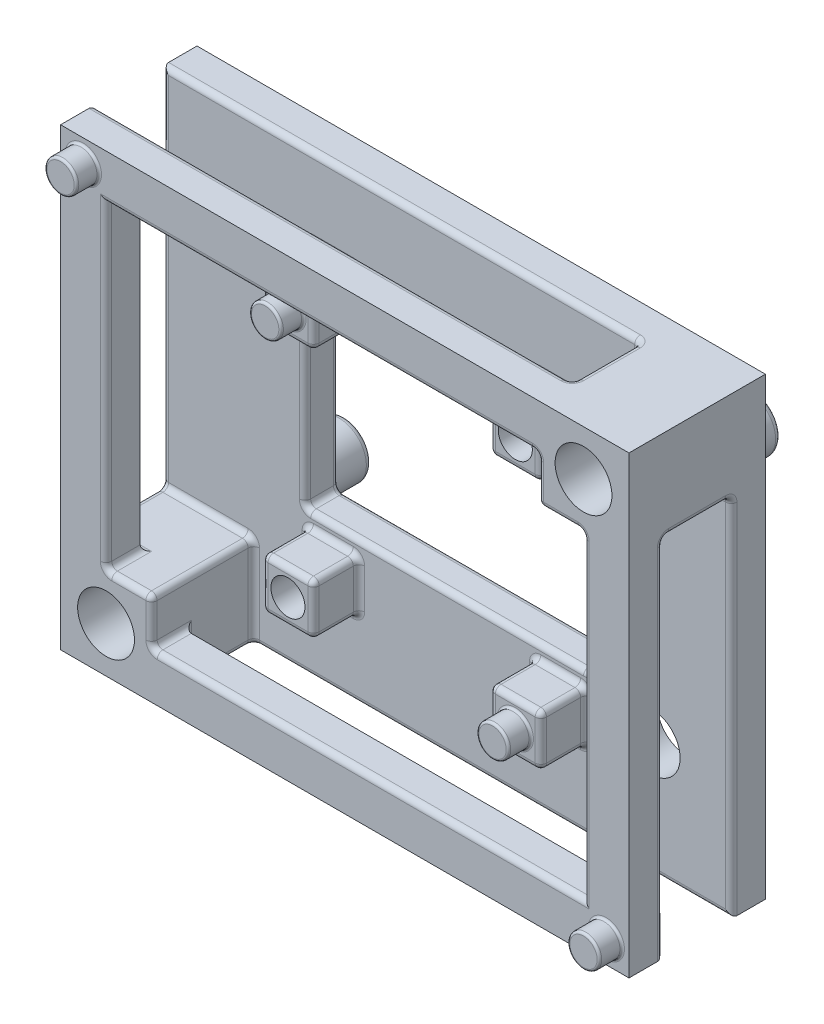
from build123d import *

# Parameters (mm, degrees)
SKETCH1_W           = 50
SKETCH1_H           = 40
BOSS_EXTRUDE1_DEPTH = 3
BOSS_EXTRUDE2_START = 1
SKETCH2_R           = 2.4
BOSS_EXTRUDE2_DEPTH = 7
SKETCH3_R           = 2.5
CUT_EXTRUDE1_DEPTH  = 15
FILLET1_R           = 0.5
SKETCH12_W          = 4.5
SKETCH12_H          = 4.5
SKETCH12_R          = 1.5
BOSS_EXTRUDE3_DEPTH = 7
SKETCH13_W          = 8
SKETCH13_H          = 8
SKETCH13_R          = 2.5
BOSS_EXTRUDE4_DEPTH = 12
BOSS_EXTRUDE5_START = 9
SKETCH14_W          = 50
SKETCH14_H          = 40
SKETCH14_W_2        = 42
SKETCH14_H_2        = 32
BOSS_EXTRUDE5_DEPTH = 3
SKETCH15_R          = 2
BOSS_EXTRUDE6_DEPTH = 7
SKETCH16_R          = 1.4
BOSS_EXTRUDE7_DEPTH = 9
CUT_EXTRUDE2_START  = -1
SKETCH17_R          = 2.5
SKETCH17_R_2        = 1.5
CUT_EXTRUDE2_DEPTH  = 15
FILLET4_R           = 0.5
FILLET5_R           = 0.5
FILLET6_R           = 0.2
FILLET7_R           = 0.2
BOSS_EXTRUDE8_START = 11
SKETCH18_R          = 1.4
BOSS_EXTRUDE8_DEPTH = 3
FILLET8_R           = 0.2
FILLET9_R           = 0.2


with BuildPart() as part:
    # Sketch1 → Boss-Extrude1 (new body)
    with BuildSketch(Plane.XY):
        Rectangle(SKETCH1_W, SKETCH1_H)
    extrude(amount=BOSS_EXTRUDE1_DEPTH)

    # Sketch2 → Boss-Extrude2 (add)
    with BuildSketch(Plane.XY.offset(BOSS_EXTRUDE2_START)):
        with Locations((18, 10)):
            Circle(SKETCH2_R)
        with Locations((-18, -10)):
            Circle(SKETCH2_R)
    extrude(amount=-BOSS_EXTRUDE2_DEPTH)

    # Sketch3 → Cut-Extrude1 (cut)
    with BuildSketch(Plane.XY):
        with Locations((18, -10)):
            Circle(SKETCH3_R)
        with Locations((-18, 10)):
            Circle(SKETCH3_R)
        with BuildLine():
            Line((-12, -7.5), (12, -7.5))
            ThreePointArc((12, -7.5), (12.353553391, -7.353553391), (12.5, -7))
            Line((12.5, -7), (12.5, 7))
            ThreePointArc((12.5, 7), (12.353553391, 7.353553391), (12, 7.5))
            Line((12, 7.5), (-12, 7.5))
            ThreePointArc((-12, 7.5), (-12.353553391, 7.353553391), (-12.5, 7))
            Line((-12.5, 7), (-12.5, -7))
            ThreePointArc((-12.5, -7), (-12.353553391, -7.353553391), (-12, -7.5))
        make_face()
    extrude(amount=CUT_EXTRUDE1_DEPTH, mode=Mode.SUBTRACT)

    # Fillet1
    fillet1_edges = [part.edges().sort_by_distance(p)[0] for p in [
        (15.6, 10, -6),
        (-20.4, -10, -6),
    ]]
    fillet(fillet1_edges, radius=FILLET1_R)

    # Sketch12 → Boss-Extrude3 (add)
    # profile 1 of 4: a face of its own
    with BuildSketch(Plane.XY):
        with Locations((-10, 11)):
            Rectangle(SKETCH12_W, SKETCH12_H)
        with Locations((-10, 11)):
            Circle(SKETCH12_R, mode=Mode.SUBTRACT)
    # profile 2 of 4: a face of its own
    with BuildSketch(Plane.XY):
        with Locations((-10, -11)):
            Rectangle(SKETCH12_W, SKETCH12_H)
        with Locations(Location((-10, -11, 0), (0, 0, 180))):
            Circle(SKETCH12_R, mode=Mode.SUBTRACT)
    # profile 3 of 4: a face of its own
    with BuildSketch(Plane.XY):
        with Locations((10, -11)):
            Rectangle(SKETCH12_W, SKETCH12_H)
        with Locations((10, -11)):
            Circle(SKETCH12_R, mode=Mode.SUBTRACT)
    # profile 4 of 4: a face of its own
    with BuildSketch(Plane.XY):
        with Locations((10, 11)):
            Rectangle(SKETCH12_W, SKETCH12_H)
        with Locations(Location((10, 11, 0), (0, 0, 180))):
            Circle(SKETCH12_R, mode=Mode.SUBTRACT)
    extrude(amount=BOSS_EXTRUDE3_DEPTH)

    # Sketch13 → Boss-Extrude4 (add)
    # profile 1 of 2: a face of its own
    with BuildSketch(Plane.XY):
        with Locations((21, 16)):
            Rectangle(SKETCH13_W, SKETCH13_H)
        with Locations((21, 16)):
            Circle(SKETCH13_R, mode=Mode.SUBTRACT)
    # profile 2 of 2: a face of its own
    with BuildSketch(Plane.XY):
        with Locations((-21, -16)):
            Rectangle(SKETCH13_W, SKETCH13_H)
        with Locations((-21, -16)):
            Circle(SKETCH13_R, mode=Mode.SUBTRACT)
    extrude(amount=BOSS_EXTRUDE4_DEPTH)

    # Sketch14 → Boss-Extrude5 (add)
    with BuildSketch(Plane.XY.offset(BOSS_EXTRUDE5_START)):
        Rectangle(SKETCH14_W, SKETCH14_H)
        Rectangle(SKETCH14_W_2, SKETCH14_H_2, mode=Mode.SUBTRACT)
    extrude(amount=BOSS_EXTRUDE5_DEPTH)

    # Sketch15 → Boss-Extrude6 (add)
    with BuildSketch(Plane.XY):
        with Locations((-10, 11)):
            Circle(SKETCH15_R)
        with Locations((10, -11)):
            Circle(SKETCH15_R)
    extrude(amount=BOSS_EXTRUDE6_DEPTH)

    # Sketch16 → Boss-Extrude7 (add)
    with BuildSketch(Plane.XY):
        with Locations((-10, 11)):
            Circle(SKETCH16_R)
        with Locations((10, -11)):
            Circle(SKETCH16_R)
    extrude(amount=BOSS_EXTRUDE7_DEPTH)

    # Sketch17 → Cut-Extrude2 (cut)
    with BuildSketch(Plane.XY.offset(CUT_EXTRUDE2_START)):
        with Locations((-21, -16)):
            Circle(SKETCH17_R)
        with Locations((21, 16)):
            Circle(SKETCH17_R)
        with Locations(Location((10, 11, 0), (0, 0, 180))):
            Circle(SKETCH17_R_2)
        with Locations(Location((-10, -11, 0), (0, 0, 180))):
            Circle(SKETCH17_R_2)
    extrude(amount=CUT_EXTRUDE2_DEPTH, mode=Mode.SUBTRACT)

    # Fillet4
    fillet4_edges = [part.edges().sort_by_distance(p)[0] for p in [
        (17, 16, 3),
        (21, 12, 3),
        (19, 12, 12),
        (17, 12, 7.5),
        (4, -20, 3),
        (-25, 4, 3),
        (-21, -12, 3),
        (-17, -16, 3),
        (-19, -12, 12),
        (-17, -12, 7.5),
        (-25, -12, 6),
        (-17, -14, 12),
        (-17, -20, 6),
        (25, 12, 6),
        (17, 14, 12),
        (17, 20, 6),
        (-4, 20, 9),
        (25, -4, 9),
        (21, -2, 12),
        (21, 12, 10.5),
        (-2, 16, 12),
        (17, 16, 10.5),
        (4, -20, 9),
        (-25, 4, 9),
        (17, 18, 9),
        (23, 12, 9),
        (-17, -18, 9),
        (-23, -12, 9),
        (-21, 2, 12),
        (-21, -12, 10.5),
        (2, -16, 12),
        (-17, -16, 10.5),
        (-12.5, 0, 3),
        (-12.353553391, -7.353553391, 3),
        (12.353553391, 7.353553391, 3),
        (0, 7.5, 3),
        (-12.353553391, 7.353553391, 3),
        (0, -7.5, 3),
        (0, -7.5, 0),
        (12.353553391, -7.353553391, 3),
        (12.353553391, -7.353553391, 0),
        (12.5, 0, 3),
        (-4, 20, 3),
        (12.5, 0, 0),
        (-12.5, 0, 0),
        (-12.353553391, 7.353553391, 0),
        (0, 7.5, 0),
        (12.353553391, 7.353553391, 0),
        (-12.353553391, -7.353553391, 0),
        (25, -4, 3),
    ]]
    fillet(fillet4_edges, radius=FILLET4_R)

    # Fillet5
    fillet5_edges = [part.edges().sort_by_distance(p)[0] for p in [
        (-12.25, -8.75, 5),
        (-12.25, -13.25, 5),
        (-7.75, -13.25, 5),
        (-7.75, -8.75, 5),
        (12.25, -11, 3),
        (10, -8.75, 3),
        (7.75, -11, 3),
        (10, -13.25, 3),
        (12.25, -11, 7),
        (10, -8.75, 7),
        (7.75, -11, 7),
        (10, -13.25, 7),
        (12.25, -13.25, 5),
        (12.25, -8.75, 5),
        (7.75, -8.75, 5),
        (7.75, -13.25, 5),
        (12.25, 11, 3),
        (10, 13.25, 3),
        (7.75, 11, 3),
        (10, 8.75, 3),
        (12.25, 11, 7),
        (10, 13.25, 7),
        (7.75, 11, 7),
        (10, 8.75, 7),
        (12.25, 8.75, 5),
        (12.25, 13.25, 5),
        (7.75, 13.25, 5),
        (7.75, 8.75, 5),
        (-7.75, 11, 3),
        (-10, 13.25, 3),
        (-12.25, 11, 3),
        (-10, 8.75, 3),
        (-7.75, 11, 7),
        (-10, 13.25, 7),
        (-12.25, 11, 7),
        (-10, 8.75, 7),
        (-7.75, 8.75, 5),
        (-7.75, 13.25, 5),
        (-12.25, 13.25, 5),
        (-12.25, 8.75, 5),
        (-12.25, -11, 3),
        (-10, -13.25, 3),
        (-7.75, -11, 3),
        (-10, -8.75, 3),
        (-12.25, -11, 7),
        (-10, -13.25, 7),
        (-7.75, -11, 7),
        (-10, -8.75, 7),
    ]]
    fillet(fillet5_edges, radius=FILLET5_R)

    # Fillet6
    fillet6_edges = [part.edges().sort_by_distance(p)[0] for p in [
        (-11.4, 11, 9),
        (8.6, -11, 9),
    ]]
    fillet(fillet6_edges, radius=FILLET6_R)

    # Fillet7
    fillet7_edges = [part.edges().sort_by_distance(p)[0] for p in [
        (-11.4, 11, 7),
        (8.6, -11, 7),
    ]]
    fillet(fillet7_edges, radius=FILLET7_R)

    # Sketch18 → Boss-Extrude8 (add)
    with BuildSketch(Plane.XY.offset(BOSS_EXTRUDE8_START)):
        with Locations((-23, 18)):
            Circle(SKETCH18_R)
        with Locations((23, -18)):
            Circle(SKETCH18_R)
    extrude(amount=BOSS_EXTRUDE8_DEPTH)

    # Fillet8
    fillet8_edges = [part.edges().sort_by_distance(p)[0] for p in [
        (-24.4, 18, 12),
        (-24.4, 18, 14),
        (21.6, -18, 12),
        (21.6, -18, 14),
    ]]
    fillet(fillet8_edges, radius=FILLET8_R)

    # Fillet9
    fillet9_edges = [part.edges().sort_by_distance(p)[0] for p in [
        (15.6, 10, 0),
        (-20.4, -10, 0),
    ]]
    fillet(fillet9_edges, radius=FILLET9_R)


solid = part.part
